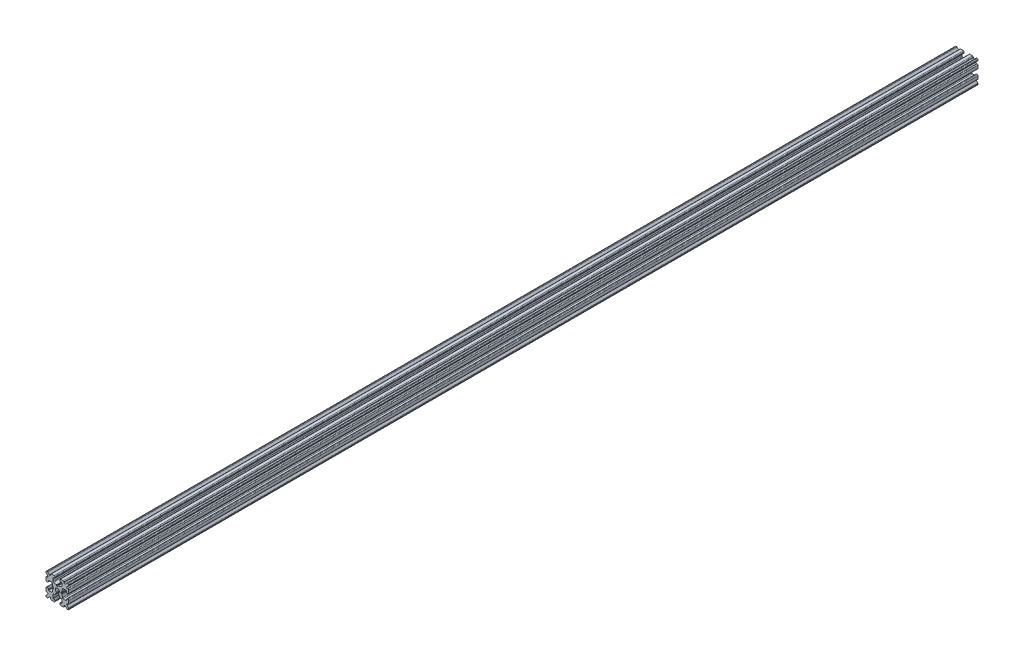
from build123d import *

# Parameters (mm, degrees)
SKETCH1_W           = 15
SKETCH1_H           = 15
SKETCH1_R           = 1.35
BOSS_EXTRUDE1_DEPTH = 300
FILLET1_R           = 0.5
CUT_EXTRUDE1_DEPTH  = 601.093742677
CUT_EXTRUDE3_DEPTH  = 601.093742677
FILLET3_R           = 0.5
FILLET4_R           = 0.5
FILLET5_R           = 3
FILLET6_R           = 0.2
CUT_EXTRUDE4_DEPTH  = 601.093742677
FILLET8_R           = 0.5
SKETCH6_W           = 6.249171159
SKETCH6_H           = 0.889
SKETCH6_W_2         = 0.889
SKETCH6_H_2         = 6.249171159
CUT_EXTRUDE5_DEPTH  = 601.093742677
CUT_EXTRUDE6_DEPTH  = 601.093742677
FILLET9_R           = 0.5
FILLET10_R          = 0.2


with BuildPart() as part:
    # Sketch1 → Boss-Extrude1 (new, symmetric)
    with BuildSketch(Plane.XY):
        Rectangle(SKETCH1_W, SKETCH1_H)
        Circle(SKETCH1_R, mode=Mode.SUBTRACT)
    extrude(amount=BOSS_EXTRUDE1_DEPTH, both=True)

    # Fillet1
    fillet1_edges = [part.edges().sort_by_distance(p)[0] for p in [
        (7.5, -7.5, 0),
        (-7.5, -7.5, 0),
        (-7.5, 7.5, 0),
        (7.5, 7.5, 0),
    ]]
    fillet(fillet1_edges, radius=FILLET1_R)

    # Sketch2 → Cut-Extrude1 (cut, through all)
    with BuildSketch(Plane.XY.offset(300)):
        Polygon((-7.5, 1.6), (-6, 1.6), (-6, 2.9), (-3.4, 2.9), (-3.4, -2.9), (-6, -2.9), (-6, -1.6), (-7.5, -1.6), align=None)
        Polygon((2.9, 6), (1.6, 6), (1.6, 7.5), (-1.6, 7.5), (-1.6, 6), (-2.9, 6), (-2.9, 3.4), (2.9, 3.4), align=None)
        Polygon((-1.6, -7.5), (-1.6, -6), (-2.9, -6), (-2.9, -3.4), (2.9, -3.4), (2.9, -6), (1.6, -6), (1.6, -7.5), align=None)
        Polygon((6, -2.9), (6, -1.6), (7.5, -1.6), (7.5, 1.6), (6, 1.6), (6, 2.9), (3.4, 2.9), (3.4, -2.9), align=None)
    extrude(amount=-CUT_EXTRUDE1_DEPTH, mode=Mode.SUBTRACT)

    # Sketch4 → Cut-Extrude3 (cut, through all)
    with BuildSketch(Plane.XY.offset(300)):
        Polygon((-3.4, 2.9), (-2.85, 0), (-3.4, -2.9), align=None)
        Polygon((-2.9, 3.4), (0, 2.85), (2.9, 3.4), align=None)
        Polygon((3.4, 2.9), (2.85, 0), (3.4, -2.9), align=None)
        Polygon((-2.9, -3.4), (0, -2.85), (2.9, -3.4), align=None)
    extrude(amount=-CUT_EXTRUDE3_DEPTH, mode=Mode.SUBTRACT)

    # Fillet3
    fillet3_edges = [part.edges().sort_by_distance(p)[0] for p in [
        (1.6, -7.5, 0),
        (-1.6, -7.5, 0),
        (-1.6, -6, 0),
        (1.6, -6, 0),
        (6, 1.6, 0),
        (7.5, 1.6, 0),
        (7.5, -1.6, 0),
        (6, -1.6, 0),
        (-7.5, -1.6, 0),
        (-7.5, 1.6, 0),
        (-6, 1.6, 0),
        (-6, -1.6, 0),
        (-1.6, 6, 0),
        (-1.6, 7.5, 0),
        (1.6, 7.5, 0),
        (1.6, 6, 0),
    ]]
    fillet(fillet3_edges, radius=FILLET3_R)

    # Fillet4
    fillet4_edges = [part.edges().sort_by_distance(p)[0] for p in [
        (-2.9, -3.4, 0),
        (2.9, -3.4, 0),
        (3.4, -2.9, 0),
        (3.4, 2.9, 0),
        (-3.4, 2.9, 0),
        (-3.4, -2.9, 0),
        (2.9, 3.4, 0),
        (-2.9, 3.4, 0),
    ]]
    fillet(fillet4_edges, radius=FILLET4_R)

    # Fillet5
    fillet5_edges = [part.edges().sort_by_distance(p)[0] for p in [
        (-2.85, 0, 0),
        (0, 2.85, 0),
        (2.85, 0, 0),
        (0, -2.85, 0),
    ]]
    fillet(fillet5_edges, radius=FILLET5_R)

    # Fillet6
    fillet6_edges = [part.edges().sort_by_distance(p)[0] for p in [
        (-2.9, -6, 0),
        (2.9, -6, 0),
        (6, -2.9, 0),
        (6, 2.9, 0),
        (-6, 2.9, 0),
        (-6, -2.9, 0),
        (2.9, 6, 0),
        (-2.9, 6, 0),
    ]]
    fillet(fillet6_edges, radius=FILLET6_R)

    # Sketch5 → Cut-Extrude4 (cut, through all)
    with BuildSketch(Plane.XY.offset(300)):
        Polygon((-7.5, 6.439339828), (-5.460660172, 4.4), (-7.5, 4.4), align=None)
        Polygon((-6.439339828, 7.5), (-4.4, 5.460660172), (-4.4, 7.5), align=None)
        Polygon((4.4, 7.5), (6.439339828, 7.5), (4.4, 5.460660172), align=None)
        Polygon((7.5, 6.439339828), (7.5, 4.4), (5.460660172, 4.4), align=None)
        Polygon((7.5, -6.439339828), (5.460660172, -4.4), (7.5, -4.4), align=None)
        Polygon((6.439339828, -7.5), (4.4, -5.460660172), (4.4, -7.5), align=None)
        Polygon((-4.4, -7.5), (-6.439339828, -7.5), (-4.4, -5.460660172), align=None)
        Polygon((-7.5, -6.439339828), (-7.5, -4.4), (-5.460660172, -4.4), align=None)
    extrude(amount=-CUT_EXTRUDE4_DEPTH, mode=Mode.SUBTRACT)

    # Fillet8
    fillet8_edges = [part.edges().sort_by_distance(p)[0] for p in [
        (-7.5, 4.4, 0),
        (-7.5, 6.439339828, 0),
        (-5.460660172, 4.4, 0),
        (7.5, -4.4, 0),
        (7.5, -6.439339828, 0),
        (5.460660172, -4.4, 0),
        (5.460660172, 4.4, 0),
        (7.5, 6.439339828, 0),
        (7.5, 4.4, 0),
        (-4.4, 7.5, 0),
        (-4.4, 5.460660172, 0),
        (-6.439339828, 7.5, 0),
        (-5.460660172, -4.4, 0),
        (-7.5, -6.439339828, 0),
        (-7.5, -4.4, 0),
        (4.4, 5.460660172, 0),
        (4.4, 7.5, 0),
        (6.439339828, 7.5, 0),
        (6.439339828, -7.5, 0),
        (4.4, -7.5, 0),
        (4.4, -5.460660172, 0),
        (-6.439339828, -7.5, 0),
        (-4.4, -5.460660172, 0),
        (-4.4, -7.5, 0),
    ]]
    fillet(fillet8_edges, radius=FILLET8_R)

    # Sketch6 → Cut-Extrude5 (cut, through all)
    with BuildSketch(Plane.XY.offset(300)):
        with Locations((5.530603002, 0)):
            Rectangle(SKETCH6_W, SKETCH6_H)
        with Locations((-5.530603002, 0)):
            Rectangle(SKETCH6_W, SKETCH6_H)
        with Locations((0, 5.530603002)):
            Rectangle(SKETCH6_W_2, SKETCH6_H_2)
    extrude(amount=-CUT_EXTRUDE5_DEPTH, mode=Mode.SUBTRACT)

    # Sketch7 → Cut-Extrude6 (cut, through all)
    with BuildSketch(Plane.XY.offset(300)):
        Polygon((0, 0), (-2.153335353, -4.617842566), (2.153335353, -4.617842566), align=None)
    extrude(amount=-CUT_EXTRUDE6_DEPTH, mode=Mode.SUBTRACT)

    # Fillet9
    fillet9_edges = [part.edges().sort_by_distance(p)[0] for p in [
        (1.457911068, -3.126500375, 0),
        (-1.457911068, -3.126500375, 0),
        (-0.570534653, -1.223515512, 0),
        (0.570534653, -1.223515512, 0),
    ]]
    fillet(fillet9_edges, radius=FILLET9_R)

    # Fillet10
    fillet10_edges = [part.edges().sort_by_distance(p)[0] for p in [
        (-2.406017422, 0.4445, 0),
        (-2.406017422, -0.4445, 0),
        (0.4445, 2.406017422, 0),
        (-0.4445, 2.406017422, 0),
        (2.406017422, 0.4445, 0),
        (2.406017422, -0.4445, 0),
        (-2.93658978, -0.4445, 0),
        (-2.93658978, 0.4445, 0),
        (2.93658978, -0.4445, 0),
        (2.93658978, 0.4445, 0),
        (0.4445, 2.93658978, 0),
        (-0.4445, 2.93658978, 0),
    ]]
    fillet(fillet10_edges, radius=FILLET10_R)


solid = part.part
